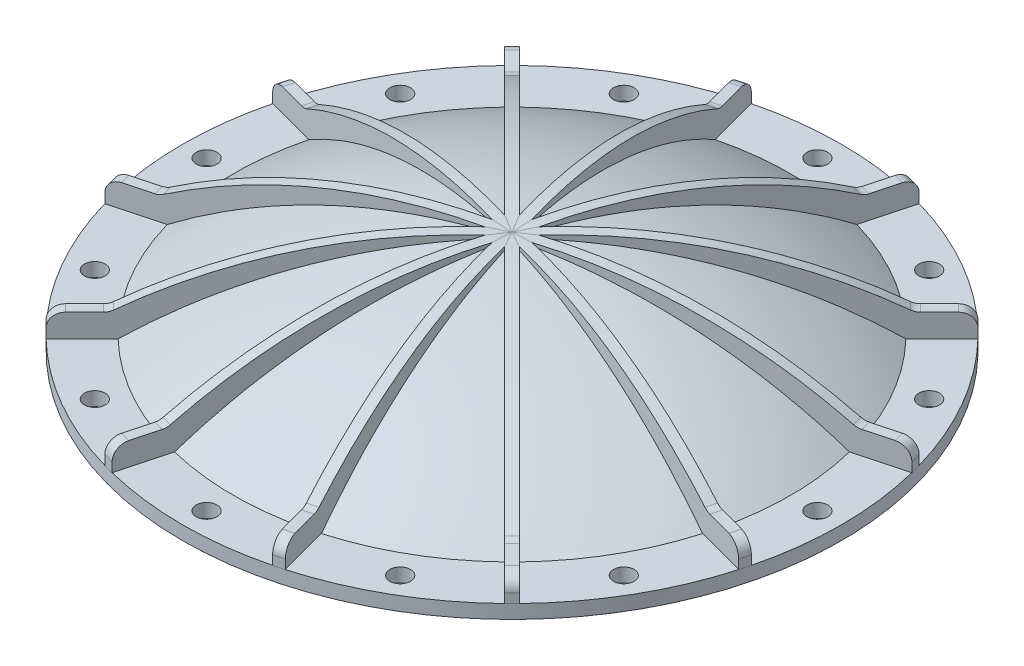
from build123d import *

# Parameters (mm, degrees)
SKETCH2_W                 = 2.33039451
SKETCH2_H                 = 3.175
EXTRUDE1_DEPTH            = 2.3876
CIRPATTERN1_COPY_1_DEPTH  = 2.3876
CIRPATTERN1_COPY_2_DEPTH  = 2.3876
CIRPATTERN1_COPY_3_DEPTH  = 2.3876
CIRPATTERN1_COPY_4_DEPTH  = 2.3876
CIRPATTERN1_COPY_5_DEPTH  = 2.3876
CIRPATTERN1_COPY_6_DEPTH  = 2.3876
CIRPATTERN1_COPY_7_DEPTH  = 2.3876
CIRPATTERN1_COPY_8_DEPTH  = 2.3876
CIRPATTERN1_COPY_9_DEPTH  = 2.3876
CIRPATTERN1_COPY_10_DEPTH = 2.3876
CIRPATTERN1_COPY_11_DEPTH = 2.3876
CIRPATTERN1_COPY_12_DEPTH = 2.3876
CIRPATTERN1_COPY_13_DEPTH = 2.3876
CIRPATTERN1_COPY_14_DEPTH = 2.3876
CIRPATTERN1_COPY_15_DEPTH = 2.3876
CIRPATTERN1_COPY_16_DEPTH = 2.3876
CIRPATTERN1_COPY_17_DEPTH = 2.3876
CIRPATTERN1_COPY_18_DEPTH = 2.3876
CIRPATTERN1_COPY_19_DEPTH = 2.3876
CIRPATTERN1_COPY_20_DEPTH = 2.3876
CIRPATTERN1_COPY_21_DEPTH = 2.3876
CIRPATTERN1_COPY_22_DEPTH = 2.3876
CIRPATTERN2_COUNT         = 12


with BuildPart() as part:
    # Sketch1 → Revolve-Thin2 (revolve)
    with BuildSketch(Plane.XY, mode=Mode.PRIVATE) as revolve_thin2_sk:
        with BuildLine():
            Line((151.840016695, 6.619575472), (128.375867971, 6.619575472))
            ThreePointArc((128.375867971, 6.619575472), (126.536487847, 6.891814308), (124.85482448, 7.685187832))
            ThreePointArc((124.85482448, 7.685187832), (66.373346234, 35.82131426), (2.408397303, 46.78535624))
            Line((2.408397303, 46.78535624), (2.601562734, 53.132417538))
            ThreePointArc((2.601562734, 53.132417538), (68.304966229, 41.870392223), (128.375867971, 12.969575472))
            Line((128.375867971, 12.969575472), (151.840016695, 12.969575472))
            Line((151.840016695, 12.969575472), (151.840016695, 6.619575472))
        make_face()
    revolve(revolve_thin2_sk.sketch.rotate(Axis((0, 0, 0), (0, 1, 0)), 90), axis=Axis((0, 0, 0), (0, 1, 0)))

    # Sketch5 → Extrude1 (add, symmetric)
    with BuildSketch(Plane(origin=(0, 0, 0), x_dir=(0.9659258262890682, 0, -0.25881904510252135), z_dir=(0.2588190451025213, 0, 0.9659258262890681))):
        with BuildLine():
            Line((151.840016695, 12.969575472), (151.840016695, 17.23432463))
            ThreePointArc((151.840016695, 17.23432463), (149.980144755, 21.72445269), (145.490016695, 23.58432463))
            Line((145.490016695, 23.58432463), (133.025487523, 23.58432463))
            ThreePointArc((133.025487523, 23.58432463), (131.396626854, 23.7967915), (129.876767422, 24.419974104))
            ThreePointArc((129.876767422, 24.419974104), (67.131112647, 48.802408617), (0, 53.795806341))
            Line((0, 53.795806341), (0, 51.364997468))
            Line((0, 51.364997468), (45.207750934, 45.114346079))
            Line((45.207750934, 45.114346079), (94.171186811, 28.098683966))
            Line((94.171186811, 28.098683966), (118.132017134, 12.969575472))
            Line((118.132017134, 12.969575472), (151.840016695, 12.969575472))
        make_face()
    extrude1 = extrude(amount=EXTRUDE1_DEPTH, both=True)

    # Mirror1: Extrude1 across plane
    add(extrude1.mirror(Plane(origin=(0, 0, 0), x_dir=(-0.8660254037844383, 0, 0.5000000000000009), z_dir=(0.5000000000000012, 0, 0.866025403784438))))

    # CirPattern1 copy 1 sketch → CirPattern1 copy 1 (add, symmetric)
    with BuildSketch(Plane(origin=(0, 0, 0), x_dir=(0.25881904510251874, 0, -0.9659258262890689), z_dir=(-0.965925826289069, 0, -0.25881904510251896))):
        with BuildLine():
            Line((151.840016695, -12.969575472), (151.840016695, -17.23432463))
            ThreePointArc((151.840016695, -17.23432463), (149.980144755, -21.72445269), (145.490016695, -23.58432463))
            Line((145.490016695, -23.58432463), (133.025487523, -23.58432463))
            ThreePointArc((133.025487523, -23.58432463), (131.396626854, -23.7967915), (129.876767422, -24.419974104))
            ThreePointArc((129.876767422, -24.419974104), (67.131112647, -48.802408617), (0, -53.795806341))
            Line((0, -53.795806341), (0, -51.364997468))
            Line((0, -51.364997468), (45.207750934, -45.114346079))
            Line((45.207750934, -45.114346079), (94.171186811, -28.098683966))
            Line((94.171186811, -28.098683966), (118.132017134, -12.969575472))
            Line((118.132017134, -12.969575472), (151.840016695, -12.969575472))
        make_face()
    extrude(amount=CIRPATTERN1_COPY_1_DEPTH, both=True)

    # CirPattern1 copy 2 sketch → CirPattern1 copy 2 (add, symmetric)
    with BuildSketch(Plane(origin=(0, 0, 0), x_dir=(-0.25881904510252285, 0, -0.9659258262890679), z_dir=(-0.9659258262890681, 0, 0.25881904510252274))):
        with BuildLine():
            Line((151.840016695, -12.969575472), (151.840016695, -17.23432463))
            ThreePointArc((151.840016695, -17.23432463), (149.980144755, -21.72445269), (145.490016695, -23.58432463))
            Line((145.490016695, -23.58432463), (133.025487523, -23.58432463))
            ThreePointArc((133.025487523, -23.58432463), (131.396626854, -23.7967915), (129.876767422, -24.419974104))
            ThreePointArc((129.876767422, -24.419974104), (67.131112647, -48.802408617), (0, -53.795806341))
            Line((0, -53.795806341), (0, -51.364997468))
            Line((0, -51.364997468), (45.207750934, -45.114346079))
            Line((45.207750934, -45.114346079), (94.171186811, -28.098683966))
            Line((94.171186811, -28.098683966), (118.132017134, -12.969575472))
            Line((118.132017134, -12.969575472), (151.840016695, -12.969575472))
        make_face()
    extrude(amount=CIRPATTERN1_COPY_2_DEPTH, both=True)

    # CirPattern1 copy 3 sketch → CirPattern1 copy 3 (add, symmetric)
    with BuildSketch(Plane(origin=(0, 0, 0), x_dir=(-0.7071067811865491, 0, -0.707106781186546), z_dir=(-0.7071067811865464, 0, 0.7071067811865491))):
        with BuildLine():
            Line((151.840016695, -12.969575472), (151.840016695, -17.23432463))
            ThreePointArc((151.840016695, -17.23432463), (149.980144755, -21.72445269), (145.490016695, -23.58432463))
            Line((145.490016695, -23.58432463), (133.025487523, -23.58432463))
            ThreePointArc((133.025487523, -23.58432463), (131.396626854, -23.7967915), (129.876767422, -24.419974104))
            ThreePointArc((129.876767422, -24.419974104), (67.131112647, -48.802408617), (0, -53.795806341))
            Line((0, -53.795806341), (0, -51.364997468))
            Line((0, -51.364997468), (45.207750934, -45.114346079))
            Line((45.207750934, -45.114346079), (94.171186811, -28.098683966))
            Line((94.171186811, -28.098683966), (118.132017134, -12.969575472))
            Line((118.132017134, -12.969575472), (151.840016695, -12.969575472))
        make_face()
    extrude(amount=CIRPATTERN1_COPY_3_DEPTH, both=True)

    # CirPattern1 copy 4 sketch → CirPattern1 copy 4 (add, symmetric)
    with BuildSketch(Plane(origin=(0, 0, 0), x_dir=(-0.9659258262890688, 0, -0.25881904510251885), z_dir=(-0.2588190451025191, 0, 0.965925826289069))):
        with BuildLine():
            Line((151.840016695, -12.969575472), (151.840016695, -17.23432463))
            ThreePointArc((151.840016695, -17.23432463), (149.980144755, -21.72445269), (145.490016695, -23.58432463))
            Line((145.490016695, -23.58432463), (133.025487523, -23.58432463))
            ThreePointArc((133.025487523, -23.58432463), (131.396626854, -23.7967915), (129.876767422, -24.419974104))
            ThreePointArc((129.876767422, -24.419974104), (67.131112647, -48.802408617), (0, -53.795806341))
            Line((0, -53.795806341), (0, -51.364997468))
            Line((0, -51.364997468), (45.207750934, -45.114346079))
            Line((45.207750934, -45.114346079), (94.171186811, -28.098683966))
            Line((94.171186811, -28.098683966), (118.132017134, -12.969575472))
            Line((118.132017134, -12.969575472), (151.840016695, -12.969575472))
        make_face()
    extrude(amount=CIRPATTERN1_COPY_4_DEPTH, both=True)

    # CirPattern1 copy 5 sketch → CirPattern1 copy 5 (add, symmetric)
    with BuildSketch(Plane(origin=(0, 0, 0), x_dir=(-0.9659258262890678, 0, 0.2588190451025229), z_dir=(0.25881904510252285, 0, 0.9659258262890682))):
        with BuildLine():
            Line((151.840016695, -12.969575472), (151.840016695, -17.23432463))
            ThreePointArc((151.840016695, -17.23432463), (149.980144755, -21.72445269), (145.490016695, -23.58432463))
            Line((145.490016695, -23.58432463), (133.025487523, -23.58432463))
            ThreePointArc((133.025487523, -23.58432463), (131.396626854, -23.7967915), (129.876767422, -24.419974104))
            ThreePointArc((129.876767422, -24.419974104), (67.131112647, -48.802408617), (0, -53.795806341))
            Line((0, -53.795806341), (0, -51.364997468))
            Line((0, -51.364997468), (45.207750934, -45.114346079))
            Line((45.207750934, -45.114346079), (94.171186811, -28.098683966))
            Line((94.171186811, -28.098683966), (118.132017134, -12.969575472))
            Line((118.132017134, -12.969575472), (151.840016695, -12.969575472))
        make_face()
    extrude(amount=CIRPATTERN1_COPY_5_DEPTH, both=True)

    # CirPattern1 copy 6 sketch → CirPattern1 copy 6 (add, symmetric)
    with BuildSketch(Plane(origin=(0, 0, 0), x_dir=(-0.7071067811865461, 0, 0.707106781186549), z_dir=(0.707106781186549, 0, 0.7071067811865464))):
        with BuildLine():
            Line((151.840016695, -12.969575472), (151.840016695, -17.23432463))
            ThreePointArc((151.840016695, -17.23432463), (149.980144755, -21.72445269), (145.490016695, -23.58432463))
            Line((145.490016695, -23.58432463), (133.025487523, -23.58432463))
            ThreePointArc((133.025487523, -23.58432463), (131.396626854, -23.7967915), (129.876767422, -24.419974104))
            ThreePointArc((129.876767422, -24.419974104), (67.131112647, -48.802408617), (0, -53.795806341))
            Line((0, -53.795806341), (0, -51.364997468))
            Line((0, -51.364997468), (45.207750934, -45.114346079))
            Line((45.207750934, -45.114346079), (94.171186811, -28.098683966))
            Line((94.171186811, -28.098683966), (118.132017134, -12.969575472))
            Line((118.132017134, -12.969575472), (151.840016695, -12.969575472))
        make_face()
    extrude(amount=CIRPATTERN1_COPY_6_DEPTH, both=True)

    # CirPattern1 copy 7 sketch → CirPattern1 copy 7 (add, symmetric)
    with BuildSketch(Plane(origin=(0, 0, 0), x_dir=(-0.2588190451025185, 0, 0.9659258262890689), z_dir=(0.9659258262890691, 0, 0.2588190451025188))):
        with BuildLine():
            Line((151.840016695, -12.969575472), (151.840016695, -17.23432463))
            ThreePointArc((151.840016695, -17.23432463), (149.980144755, -21.72445269), (145.490016695, -23.58432463))
            Line((145.490016695, -23.58432463), (133.025487523, -23.58432463))
            ThreePointArc((133.025487523, -23.58432463), (131.396626854, -23.7967915), (129.876767422, -24.419974104))
            ThreePointArc((129.876767422, -24.419974104), (67.131112647, -48.802408617), (0, -53.795806341))
            Line((0, -53.795806341), (0, -51.364997468))
            Line((0, -51.364997468), (45.207750934, -45.114346079))
            Line((45.207750934, -45.114346079), (94.171186811, -28.098683966))
            Line((94.171186811, -28.098683966), (118.132017134, -12.969575472))
            Line((118.132017134, -12.969575472), (151.840016695, -12.969575472))
        make_face()
    extrude(amount=CIRPATTERN1_COPY_7_DEPTH, both=True)

    # CirPattern1 copy 8 sketch → CirPattern1 copy 8 (add, symmetric)
    with BuildSketch(Plane(origin=(0, 0, 0), x_dir=(0.25881904510252246, 0, 0.9659258262890679), z_dir=(0.9659258262890682, 0, -0.2588190451025223))):
        with BuildLine():
            Line((151.840016695, -12.969575472), (151.840016695, -17.23432463))
            ThreePointArc((151.840016695, -17.23432463), (149.980144755, -21.72445269), (145.490016695, -23.58432463))
            Line((145.490016695, -23.58432463), (133.025487523, -23.58432463))
            ThreePointArc((133.025487523, -23.58432463), (131.396626854, -23.7967915), (129.876767422, -24.419974104))
            ThreePointArc((129.876767422, -24.419974104), (67.131112647, -48.802408617), (0, -53.795806341))
            Line((0, -53.795806341), (0, -51.364997468))
            Line((0, -51.364997468), (45.207750934, -45.114346079))
            Line((45.207750934, -45.114346079), (94.171186811, -28.098683966))
            Line((94.171186811, -28.098683966), (118.132017134, -12.969575472))
            Line((118.132017134, -12.969575472), (151.840016695, -12.969575472))
        make_face()
    extrude(amount=CIRPATTERN1_COPY_8_DEPTH, both=True)

    # CirPattern1 copy 9 sketch → CirPattern1 copy 9 (add, symmetric)
    with BuildSketch(Plane(origin=(0, 0, 0), x_dir=(0.707106781186549, 0, 0.7071067811865461), z_dir=(0.7071067811865465, 0, -0.707106781186549))):
        with BuildLine():
            Line((151.840016695, -12.969575472), (151.840016695, -17.23432463))
            ThreePointArc((151.840016695, -17.23432463), (149.980144755, -21.72445269), (145.490016695, -23.58432463))
            Line((145.490016695, -23.58432463), (133.025487523, -23.58432463))
            ThreePointArc((133.025487523, -23.58432463), (131.396626854, -23.7967915), (129.876767422, -24.419974104))
            ThreePointArc((129.876767422, -24.419974104), (67.131112647, -48.802408617), (0, -53.795806341))
            Line((0, -53.795806341), (0, -51.364997468))
            Line((0, -51.364997468), (45.207750934, -45.114346079))
            Line((45.207750934, -45.114346079), (94.171186811, -28.098683966))
            Line((94.171186811, -28.098683966), (118.132017134, -12.969575472))
            Line((118.132017134, -12.969575472), (151.840016695, -12.969575472))
        make_face()
    extrude(amount=CIRPATTERN1_COPY_9_DEPTH, both=True)

    # CirPattern1 copy 10 sketch → CirPattern1 copy 10 (add, symmetric)
    with BuildSketch(Plane(origin=(0, 0, 0), x_dir=(0.9659258262890689, 0, 0.2588190451025185), z_dir=(0.2588190451025188, 0, -0.9659258262890691))):
        with BuildLine():
            Line((151.840016695, -12.969575472), (151.840016695, -17.23432463))
            ThreePointArc((151.840016695, -17.23432463), (149.980144755, -21.72445269), (145.490016695, -23.58432463))
            Line((145.490016695, -23.58432463), (133.025487523, -23.58432463))
            ThreePointArc((133.025487523, -23.58432463), (131.396626854, -23.7967915), (129.876767422, -24.419974104))
            ThreePointArc((129.876767422, -24.419974104), (67.131112647, -48.802408617), (0, -53.795806341))
            Line((0, -53.795806341), (0, -51.364997468))
            Line((0, -51.364997468), (45.207750934, -45.114346079))
            Line((45.207750934, -45.114346079), (94.171186811, -28.098683966))
            Line((94.171186811, -28.098683966), (118.132017134, -12.969575472))
            Line((118.132017134, -12.969575472), (151.840016695, -12.969575472))
        make_face()
    extrude(amount=CIRPATTERN1_COPY_10_DEPTH, both=True)

    # CirPattern1 copy 11 sketch → CirPattern1 copy 11 (add, symmetric)
    with BuildSketch(Plane(origin=(0, 0, 0), x_dir=(0.9659258262890679, 0, -0.25881904510252246), z_dir=(-0.2588190451025223, 0, -0.9659258262890682))):
        with BuildLine():
            Line((151.840016695, -12.969575472), (151.840016695, -17.23432463))
            ThreePointArc((151.840016695, -17.23432463), (149.980144755, -21.72445269), (145.490016695, -23.58432463))
            Line((145.490016695, -23.58432463), (133.025487523, -23.58432463))
            ThreePointArc((133.025487523, -23.58432463), (131.396626854, -23.7967915), (129.876767422, -24.419974104))
            ThreePointArc((129.876767422, -24.419974104), (67.131112647, -48.802408617), (0, -53.795806341))
            Line((0, -53.795806341), (0, -51.364997468))
            Line((0, -51.364997468), (45.207750934, -45.114346079))
            Line((45.207750934, -45.114346079), (94.171186811, -28.098683966))
            Line((94.171186811, -28.098683966), (118.132017134, -12.969575472))
            Line((118.132017134, -12.969575472), (151.840016695, -12.969575472))
        make_face()
    extrude(amount=CIRPATTERN1_COPY_11_DEPTH, both=True)

    # CirPattern1 copy 12 sketch → CirPattern1 copy 12 (add, symmetric)
    with BuildSketch(Plane(origin=(0, 0, 0), x_dir=(0.7071067811865472, 0, -0.7071067811865479), z_dir=(0.7071067811865479, 0, 0.7071067811865472))):
        with BuildLine():
            Line((151.840016695, 12.969575472), (151.840016695, 17.23432463))
            ThreePointArc((151.840016695, 17.23432463), (149.980144755, 21.72445269), (145.490016695, 23.58432463))
            Line((145.490016695, 23.58432463), (133.025487523, 23.58432463))
            ThreePointArc((133.025487523, 23.58432463), (131.396626854, 23.7967915), (129.876767422, 24.419974104))
            ThreePointArc((129.876767422, 24.419974104), (67.131112647, 48.802408617), (0, 53.795806341))
            Line((0, 53.795806341), (0, 51.364997468))
            Line((0, 51.364997468), (45.207750934, 45.114346079))
            Line((45.207750934, 45.114346079), (94.171186811, 28.098683966))
            Line((94.171186811, 28.098683966), (118.132017134, 12.969575472))
            Line((118.132017134, 12.969575472), (151.840016695, 12.969575472))
        make_face()
    extrude(amount=CIRPATTERN1_COPY_12_DEPTH, both=True)

    # CirPattern1 copy 13 sketch → CirPattern1 copy 13 (add, symmetric)
    with BuildSketch(Plane(origin=(0, 0, 0), x_dir=(0.2588190451025203, 0, -0.9659258262890685), z_dir=(0.9659258262890684, 0, 0.2588190451025203))):
        with BuildLine():
            Line((151.840016695, 12.969575472), (151.840016695, 17.23432463))
            ThreePointArc((151.840016695, 17.23432463), (149.980144755, 21.72445269), (145.490016695, 23.58432463))
            Line((145.490016695, 23.58432463), (133.025487523, 23.58432463))
            ThreePointArc((133.025487523, 23.58432463), (131.396626854, 23.7967915), (129.876767422, 24.419974104))
            ThreePointArc((129.876767422, 24.419974104), (67.131112647, 48.802408617), (0, 53.795806341))
            Line((0, 53.795806341), (0, 51.364997468))
            Line((0, 51.364997468), (45.207750934, 45.114346079))
            Line((45.207750934, 45.114346079), (94.171186811, 28.098683966))
            Line((94.171186811, 28.098683966), (118.132017134, 12.969575472))
            Line((118.132017134, 12.969575472), (151.840016695, 12.969575472))
        make_face()
    extrude(amount=CIRPATTERN1_COPY_13_DEPTH, both=True)

    # CirPattern1 copy 14 sketch → CirPattern1 copy 14 (add, symmetric)
    with BuildSketch(Plane(origin=(0, 0, 0), x_dir=(-0.2588190451025213, 0, -0.9659258262890682), z_dir=(0.9659258262890681, 0, -0.25881904510252124))):
        with BuildLine():
            Line((151.840016695, 12.969575472), (151.840016695, 17.23432463))
            ThreePointArc((151.840016695, 17.23432463), (149.980144755, 21.72445269), (145.490016695, 23.58432463))
            Line((145.490016695, 23.58432463), (133.025487523, 23.58432463))
            ThreePointArc((133.025487523, 23.58432463), (131.396626854, 23.7967915), (129.876767422, 24.419974104))
            ThreePointArc((129.876767422, 24.419974104), (67.131112647, 48.802408617), (0, 53.795806341))
            Line((0, 53.795806341), (0, 51.364997468))
            Line((0, 51.364997468), (45.207750934, 45.114346079))
            Line((45.207750934, 45.114346079), (94.171186811, 28.098683966))
            Line((94.171186811, 28.098683966), (118.132017134, 12.969575472))
            Line((118.132017134, 12.969575472), (151.840016695, 12.969575472))
        make_face()
    extrude(amount=CIRPATTERN1_COPY_14_DEPTH, both=True)

    # CirPattern1 copy 15 sketch → CirPattern1 copy 15 (add, symmetric)
    with BuildSketch(Plane(origin=(0, 0, 0), x_dir=(-0.7071067811865478, 0, -0.7071067811865474), z_dir=(0.7071067811865472, 0, -0.7071067811865477))):
        with BuildLine():
            Line((151.840016695, 12.969575472), (151.840016695, 17.23432463))
            ThreePointArc((151.840016695, 17.23432463), (149.980144755, 21.72445269), (145.490016695, 23.58432463))
            Line((145.490016695, 23.58432463), (133.025487523, 23.58432463))
            ThreePointArc((133.025487523, 23.58432463), (131.396626854, 23.7967915), (129.876767422, 24.419974104))
            ThreePointArc((129.876767422, 24.419974104), (67.131112647, 48.802408617), (0, 53.795806341))
            Line((0, 53.795806341), (0, 51.364997468))
            Line((0, 51.364997468), (45.207750934, 45.114346079))
            Line((45.207750934, 45.114346079), (94.171186811, 28.098683966))
            Line((94.171186811, 28.098683966), (118.132017134, 12.969575472))
            Line((118.132017134, 12.969575472), (151.840016695, 12.969575472))
        make_face()
    extrude(amount=CIRPATTERN1_COPY_15_DEPTH, both=True)

    # CirPattern1 copy 16 sketch → CirPattern1 copy 16 (add, symmetric)
    with BuildSketch(Plane(origin=(0, 0, 0), x_dir=(-0.9659258262890686, 0, -0.25881904510252013), z_dir=(0.25881904510252013, 0, -0.9659258262890684))):
        with BuildLine():
            Line((151.840016695, 12.969575472), (151.840016695, 17.23432463))
            ThreePointArc((151.840016695, 17.23432463), (149.980144755, 21.72445269), (145.490016695, 23.58432463))
            Line((145.490016695, 23.58432463), (133.025487523, 23.58432463))
            ThreePointArc((133.025487523, 23.58432463), (131.396626854, 23.7967915), (129.876767422, 24.419974104))
            ThreePointArc((129.876767422, 24.419974104), (67.131112647, 48.802408617), (0, 53.795806341))
            Line((0, 53.795806341), (0, 51.364997468))
            Line((0, 51.364997468), (45.207750934, 45.114346079))
            Line((45.207750934, 45.114346079), (94.171186811, 28.098683966))
            Line((94.171186811, 28.098683966), (118.132017134, 12.969575472))
            Line((118.132017134, 12.969575472), (151.840016695, 12.969575472))
        make_face()
    extrude(amount=CIRPATTERN1_COPY_16_DEPTH, both=True)

    # CirPattern1 copy 17 sketch → CirPattern1 copy 17 (add, symmetric)
    with BuildSketch(Plane(origin=(0, 0, 0), x_dir=(-0.9659258262890682, 0, 0.25881904510252124), z_dir=(-0.2588190451025212, 0, -0.9659258262890681))):
        with BuildLine():
            Line((151.840016695, 12.969575472), (151.840016695, 17.23432463))
            ThreePointArc((151.840016695, 17.23432463), (149.980144755, 21.72445269), (145.490016695, 23.58432463))
            Line((145.490016695, 23.58432463), (133.025487523, 23.58432463))
            ThreePointArc((133.025487523, 23.58432463), (131.396626854, 23.7967915), (129.876767422, 24.419974104))
            ThreePointArc((129.876767422, 24.419974104), (67.131112647, 48.802408617), (0, 53.795806341))
            Line((0, 53.795806341), (0, 51.364997468))
            Line((0, 51.364997468), (45.207750934, 45.114346079))
            Line((45.207750934, 45.114346079), (94.171186811, 28.098683966))
            Line((94.171186811, 28.098683966), (118.132017134, 12.969575472))
            Line((118.132017134, 12.969575472), (151.840016695, 12.969575472))
        make_face()
    extrude(amount=CIRPATTERN1_COPY_17_DEPTH, both=True)

    # CirPattern1 copy 18 sketch → CirPattern1 copy 18 (add, symmetric)
    with BuildSketch(Plane(origin=(0, 0, 0), x_dir=(-0.7071067811865471, 0, 0.7071067811865481), z_dir=(-0.707106781186548, 0, -0.707106781186547))):
        with BuildLine():
            Line((151.840016695, 12.969575472), (151.840016695, 17.23432463))
            ThreePointArc((151.840016695, 17.23432463), (149.980144755, 21.72445269), (145.490016695, 23.58432463))
            Line((145.490016695, 23.58432463), (133.025487523, 23.58432463))
            ThreePointArc((133.025487523, 23.58432463), (131.396626854, 23.7967915), (129.876767422, 24.419974104))
            ThreePointArc((129.876767422, 24.419974104), (67.131112647, 48.802408617), (0, 53.795806341))
            Line((0, 53.795806341), (0, 51.364997468))
            Line((0, 51.364997468), (45.207750934, 45.114346079))
            Line((45.207750934, 45.114346079), (94.171186811, 28.098683966))
            Line((94.171186811, 28.098683966), (118.132017134, 12.969575472))
            Line((118.132017134, 12.969575472), (151.840016695, 12.969575472))
        make_face()
    extrude(amount=CIRPATTERN1_COPY_18_DEPTH, both=True)

    # CirPattern1 copy 19 sketch → CirPattern1 copy 19 (add, symmetric)
    with BuildSketch(Plane(origin=(0, 0, 0), x_dir=(-0.25881904510252074, 0, 0.9659258262890684), z_dir=(-0.9659258262890682, 0, -0.25881904510252074))):
        with BuildLine():
            Line((151.840016695, 12.969575472), (151.840016695, 17.23432463))
            ThreePointArc((151.840016695, 17.23432463), (149.980144755, 21.72445269), (145.490016695, 23.58432463))
            Line((145.490016695, 23.58432463), (133.025487523, 23.58432463))
            ThreePointArc((133.025487523, 23.58432463), (131.396626854, 23.7967915), (129.876767422, 24.419974104))
            ThreePointArc((129.876767422, 24.419974104), (67.131112647, 48.802408617), (0, 53.795806341))
            Line((0, 53.795806341), (0, 51.364997468))
            Line((0, 51.364997468), (45.207750934, 45.114346079))
            Line((45.207750934, 45.114346079), (94.171186811, 28.098683966))
            Line((94.171186811, 28.098683966), (118.132017134, 12.969575472))
            Line((118.132017134, 12.969575472), (151.840016695, 12.969575472))
        make_face()
    extrude(amount=CIRPATTERN1_COPY_19_DEPTH, both=True)

    # CirPattern1 copy 20 sketch → CirPattern1 copy 20 (add, symmetric)
    with BuildSketch(Plane(origin=(0, 0, 0), x_dir=(0.2588190451025212, 0, 0.9659258262890682), z_dir=(-0.9659258262890681, 0, 0.25881904510252113))):
        with BuildLine():
            Line((151.840016695, 12.969575472), (151.840016695, 17.23432463))
            ThreePointArc((151.840016695, 17.23432463), (149.980144755, 21.72445269), (145.490016695, 23.58432463))
            Line((145.490016695, 23.58432463), (133.025487523, 23.58432463))
            ThreePointArc((133.025487523, 23.58432463), (131.396626854, 23.7967915), (129.876767422, 24.419974104))
            ThreePointArc((129.876767422, 24.419974104), (67.131112647, 48.802408617), (0, 53.795806341))
            Line((0, 53.795806341), (0, 51.364997468))
            Line((0, 51.364997468), (45.207750934, 45.114346079))
            Line((45.207750934, 45.114346079), (94.171186811, 28.098683966))
            Line((94.171186811, 28.098683966), (118.132017134, 12.969575472))
            Line((118.132017134, 12.969575472), (151.840016695, 12.969575472))
        make_face()
    extrude(amount=CIRPATTERN1_COPY_20_DEPTH, both=True)

    # CirPattern1 copy 21 sketch → CirPattern1 copy 21 (add, symmetric)
    with BuildSketch(Plane(origin=(0, 0, 0), x_dir=(0.7071067811865481, 0, 0.7071067811865471), z_dir=(-0.707106781186547, 0, 0.707106781186548))):
        with BuildLine():
            Line((151.840016695, 12.969575472), (151.840016695, 17.23432463))
            ThreePointArc((151.840016695, 17.23432463), (149.980144755, 21.72445269), (145.490016695, 23.58432463))
            Line((145.490016695, 23.58432463), (133.025487523, 23.58432463))
            ThreePointArc((133.025487523, 23.58432463), (131.396626854, 23.7967915), (129.876767422, 24.419974104))
            ThreePointArc((129.876767422, 24.419974104), (67.131112647, 48.802408617), (0, 53.795806341))
            Line((0, 53.795806341), (0, 51.364997468))
            Line((0, 51.364997468), (45.207750934, 45.114346079))
            Line((45.207750934, 45.114346079), (94.171186811, 28.098683966))
            Line((94.171186811, 28.098683966), (118.132017134, 12.969575472))
            Line((118.132017134, 12.969575472), (151.840016695, 12.969575472))
        make_face()
    extrude(amount=CIRPATTERN1_COPY_21_DEPTH, both=True)

    # CirPattern1 copy 22 sketch → CirPattern1 copy 22 (add, symmetric)
    with BuildSketch(Plane(origin=(0, 0, 0), x_dir=(0.9659258262890684, 0, 0.25881904510252074), z_dir=(-0.25881904510252074, 0, 0.9659258262890682))):
        with BuildLine():
            Line((151.840016695, 12.969575472), (151.840016695, 17.23432463))
            ThreePointArc((151.840016695, 17.23432463), (149.980144755, 21.72445269), (145.490016695, 23.58432463))
            Line((145.490016695, 23.58432463), (133.025487523, 23.58432463))
            ThreePointArc((133.025487523, 23.58432463), (131.396626854, 23.7967915), (129.876767422, 24.419974104))
            ThreePointArc((129.876767422, 24.419974104), (67.131112647, 48.802408617), (0, 53.795806341))
            Line((0, 53.795806341), (0, 51.364997468))
            Line((0, 51.364997468), (45.207750934, 45.114346079))
            Line((45.207750934, 45.114346079), (94.171186811, 28.098683966))
            Line((94.171186811, 28.098683966), (118.132017134, 12.969575472))
            Line((118.132017134, 12.969575472), (151.840016695, 12.969575472))
        make_face()
    extrude(amount=CIRPATTERN1_COPY_22_DEPTH, both=True)

    # Sketch8 → 3/8 (0.375) Diameter Hole1 (revolve, cut)
    with BuildSketch(Plane(origin=(0, 12.969575472, -140.733170205), x_dir=(0, 0, 1), z_dir=(1, 0, 0))):
        Polygon((0, 0), (0, 28.261598698), (4.7625, 25.4), (4.7625, 0), align=None)
    f_3_8_0_375_diameter_hole1 = revolve(axis=Axis((0, 19.319575472, -140.733170205), (0, -1, 0)), mode=Mode.SUBTRACT)

    # CirPattern2: 3/8 (0.375) Diameter Hole1 ×12 about axis
    cirpattern2_axis = Axis((0, 0, 0), (0, 1, 0))
    for i in range(1, CIRPATTERN2_COUNT):
        add(f_3_8_0_375_diameter_hole1.rotate(cirpattern2_axis, i * 360 / CIRPATTERN2_COUNT), mode=Mode.SUBTRACT)


with BuildPart() as body_2:
    # Sketch2 → Revolve-Thin3 (revolve)
    with BuildSketch(Plane.XY, mode=Mode.PRIVATE) as revolve_thin3_sk:
        with Locations((1.165197255, 48.277271786)):
            Rectangle(SKETCH2_W, SKETCH2_H)
    revolve(revolve_thin3_sk.sketch.rotate(Axis((0, 46.689771786, 0), (0, 1, 0)), 90), axis=Axis((0, 46.689771786, 0), (0, 1, 0)))


solid = Compound([part.part, body_2.part])
